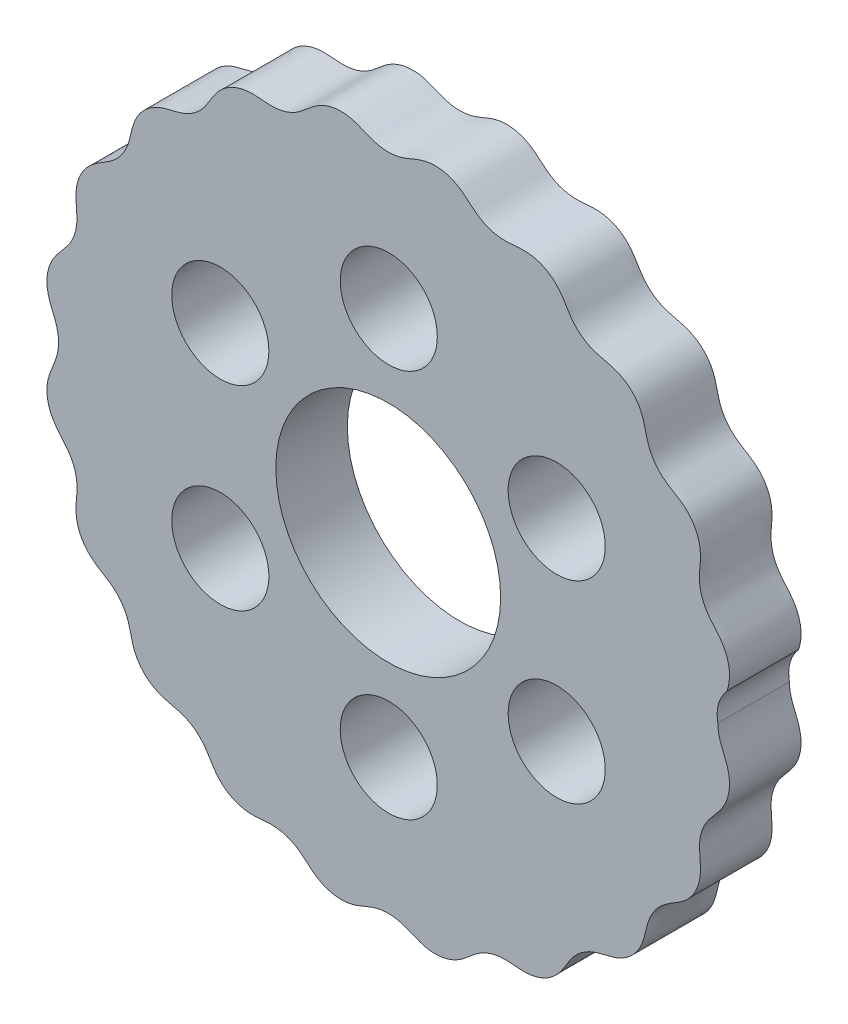
from build123d import *

# Parameters (mm, degrees)
BOSS_EXTRUDE1_DEPTH = 7
SKETCH2_R           = 11
SKETCH2_R_2         = 4.75
SKETCH2_R_3         = 4.749999995
SKETCH2_R_4         = 4.750000007
SKETCH2_R_5         = 4.750000003
CUT_EXTRUDE3_DEPTH  = 48.733141781


with BuildPart() as part:
    # Sketch1 → Boss-Extrude1 (new body)
    with BuildSketch(Plane.XY):
        with BuildLine():
            add(Edge.make_bspline(
                [(32.25, 1e-09), (32.25, -0.03584026), (32.251080395, -0.107557917), (32.255942168, -0.244822693), (32.268861596, -0.42423358), (32.288126492, -0.590307491), (32.313597344, -0.75526022), (32.345083769, -0.921284338), (32.382340363, -1.086200834), (32.435743217, -1.290221504), (32.510017409, -1.532192074), (32.609572454, -1.810337489), (32.736031435, -2.123211782), (32.868409264, -2.433561535), (32.998463612, -2.744978513), (33.147670028, -3.139574299), (33.29203351, -3.625611027), (33.391238098, -4.209938144), (33.40159236, -4.963887179), (33.263092101, -5.783976593), (32.933637021, -6.632976673), (32.380720256, -7.44914111), (31.743633074, -8.128548572), (31.194565339, -8.824864423), (30.792041933, -9.563839804), (30.542619062, -10.317563139), (30.426059081, -11.150959974), (30.453700427, -12.037430256), (30.571486472, -12.961397721), (30.548973562, -13.946062453), (30.305827306, -14.908972914), (29.8488621, -15.794930036), (29.197566297, -16.55957303), (28.387565065, -17.156146763), (27.550974388, -17.611279668), (26.8094699, -18.137433767), (26.205567855, -18.754025976), (25.754198906, -19.433148369), (25.419097837, -20.210957063), (25.205654831, -21.059332432), (25.023165763, -21.946222304), (24.678918541, -22.824303369), (24.155385031, -23.610913554), (23.47258695, -24.266165938), (22.663154471, -24.7596191), (21.767380441, -25.068988477), (20.873877723, -25.241670484), (20.026176208, -25.483558737), (19.257961529, -25.852796939), (18.597014435, -26.339289543), (18.015319336, -26.96235034), (17.530200194, -27.697909274), (17.088002691, -28.493747234), (16.507844893, -29.243486782), (15.772859754, -29.859313296), (14.912564693, -30.302576631), (13.965315475, -30.54635699), (12.98025215, -30.573037387), (12.056322353, -30.455886167), (11.169960105, -30.425170838), (10.336137669, -30.538425829), (9.581252254, -30.784420953), (8.840709776, -31.184040969), (8.142429819, -31.730755162), (7.463613048, -32.368451781), (6.650013052, -32.924567132), (5.739798426, -33.282624756), (4.783005447, -33.428033479), (3.826528798, -33.360257301), (2.916983602, -33.093242599), (2.091628303, -32.709045741), (1.26637753, -32.40011834), (0.429302587, -32.239240586), (-0.391382596, -32.235565239), (-1.22968536, -32.389684614), (-2.0572378, -32.693302158), (-2.881721983, -33.078601543), (-3.788770237, -33.353385358), (-4.733774423, -33.42838768), (-5.671092486, -33.298000902), (-6.556445254, -32.967881994), (-7.350178183, -32.458558488), (-8.018687609, -31.847917072), (-8.690679722, -31.287739131), (-9.419625653, -30.856516656), (-10.184465575, -30.573711459), (-11.03571026, -30.431180216), (-11.944792517, -30.442626541), (-12.889163565, -30.566141215), (-13.895181285, -30.557956001), (-14.87113339, -30.320567678), (-15.760797756, -29.870869827), (-16.522447913, -29.233522337), (-17.118094619, -28.449212827), (-17.565712962, -27.632421294), (-18.065390764, -26.899614077), (-18.650481966, -26.294814018), (-19.296064795, -25.832745125), (-20.056657392, -25.472681848), (-20.910331773, -25.233134263), (-21.825203321, -25.057736755), (-22.751582791, -24.720739593), (-23.573115298, -24.189933119), (-24.248840304, -23.497093196), (-24.751359701, -22.680439304), (-25.064603709, -21.786008149), (-25.237894516, -20.892406484), (-25.476928432, -20.044090314), (-25.843074795, -19.274341716), (-26.326600825, -18.611224875), (-26.947330385, -18.027030012), (-27.681412221, -17.539453985), (-28.477538309, -17.097997439), (-29.229618148, -16.521157931), (-29.848604233, -15.788832927), (-30.295754573, -14.930542362), (-30.543605502, -13.984363508), (-30.57456144, -12.999231857), (-30.458084156, -12.075098728), (-30.424367357, -11.188988864), (-30.534311318, -10.354690195), (-30.776875242, -9.598734005), (-31.173567909, -8.856576796), (-31.717880897, -8.156414765), (-32.356136698, -7.477963354), (-32.915398504, -6.667140338), (-33.283154456, -5.744604994), (-33.432509226, -4.758990118), (-33.353397152, -3.75766975), (-33.047197129, -2.799491173), (-32.637917259, -1.939569952), (-32.348479254, -1.077600722), (-32.223693767, -0.223626791), (-32.259097298, 0.591019042), (-32.446410543, 1.416966955), (-32.773243466, 2.228342112), (-33.146425069, 3.05346988), (-33.382488072, 3.966548555), (-33.420035871, 4.916249167), (-33.247541542, 5.857668601), (-32.870746257, 6.745815511), (-32.306284436, 7.533437088), (-31.679184935, 8.200013939), (-31.151082078, 8.893226913), (-30.767724626, 9.62347225), (-30.533327538, 10.364780464), (-30.425852641, 11.182587503), (-30.456115217, 12.053028073), (-30.57044759, 12.961496123), (-30.549533517, 13.930765879), (-30.315621222, 14.877939042), (-29.87541213, 15.751878255), (-29.247523253, 16.509050406), (-28.46544523, 17.108273666), (-27.648960196, 17.55636261), (-26.914470828, 18.053478276), (-26.307340893, 18.636141864), (-25.842338245, 19.279662272), (-25.479266059, 20.038804033), (-25.236815929, 20.891806711), (-25.062198676, 21.806705948), (-24.729295697, 22.734354454), (-24.20202431, 23.558169194), (-23.512255201, 24.237008277), (-22.697777389, 24.74303772), (-21.804533826, 25.060153895), (-20.910965853, 25.234161069), (-20.061987548, 25.470376036), (-19.290772545, 25.833422728), (-18.625484989, 26.313982965), (-18.0388195, 26.93231861), (-17.548735535, 27.664959335), (-17.10796282, 28.461209915), (-16.534392163, 29.215784218), (-15.812944863, 29.830728484), (-14.977234069, 30.274744494), (-14.066517637, 30.526562287), (-13.124972172, 30.579491021), (-12.225320095, 30.477855894), (-11.352300693, 30.420611213), (-10.509198984, 30.5014714), (-9.724582773, 30.723575454), (-8.952700657, 31.109863531), (-8.224799511, 31.654406363), (-7.53328827, 32.309492131), (-6.713650395, 32.892779932), (-5.778866527, 33.275025561), (-4.783689107, 33.432306412), (-3.776579779, 33.356996625), (-2.817028253, 33.054939744), (-1.956947609, 32.645597809), (-1.096221684, 32.353093368), (-0.24268098, 32.224753798), (0.572143478, 32.256517558), (1.398855976, 32.440618518), (2.211303462, 32.765181102), (3.035622993, 33.139660067), (3.947616622, 33.379700709), (4.891604445, 33.421034296), (5.823512573, 33.256381407), (6.69945148, 32.893917966), (7.477767129, 32.353045748), (8.142948467, 31.731914513), (8.835724848, 31.186903416), (9.584991508, 30.780564963), (10.366383266, 30.529626848), (11.212102964, 30.423164574), (12.092486758, 30.461281464), (12.99612118, 30.571807634), (13.943649273, 30.545643795), (14.874489725, 30.315479217), (15.739983569, 29.882441225), (16.495629409, 29.261403498), (17.098384886, 28.481668508), (17.547072979, 27.665471693), (18.041630009, 26.929367925), (18.621868133, 26.319917893), (19.263294063, 25.852011417), (20.020958736, 25.485922122), (20.873264512, 25.240541889), (21.788177848, 25.066597447), (22.717076691, 24.737783832), (23.543166874, 24.214052248), (24.225109953, 23.527364126), (24.734646511, 22.715070024), (25.0556406, 21.823032223), (25.230470514, 20.929510983), (25.463891902, 20.079894914), (25.823854301, 19.307238044), (26.301409548, 18.639811686), (26.917359159, 18.050670837), (27.648460376, 17.558076142), (28.444909927, 17.117856696), (29.201785946, 16.547605137), (29.81984157, 15.82878727), (30.267636372, 14.995097053), (30.523375754, 14.085436493), (30.580435366, 13.144017152), (30.480213655, 12.243995051), (30.420588583, 11.371383627), (30.497965021, 10.527830776), (30.716858994, 9.742562755), (31.099373189, 8.968622161), (31.567480712, 8.340299437), (32.038361194, 7.819076523), (32.437316878, 7.337829001), (32.724515784, 6.927769227), (32.967242303, 6.489680677), (33.159093214, 6.026952619), (33.298790924, 5.536156351), (33.370144453, 5.089484367), (33.392607682, 4.695978095), (33.384025491, 4.360403743), (33.360509543, 4.092595223), (33.325535309, 3.859348386), (33.287278414, 3.665828734), (33.246547966, 3.497829168), (33.208210173, 3.357605542), (33.178892757, 3.259230135), (33.161701284, 3.204461577), (33.1529127, 3.177331049)],
                knots=[0.074412945, 0.074412945, 0.074412945, 0.074412945, 0.074412945, 0.075079832, 0.075746718, 0.076413605, 0.077080492, 0.077747379, 0.078414266, 0.079081153, 0.07974804, 0.081081814, 0.082415588, 0.083749362, 0.085083135, 0.086416909, 0.087750683, 0.090418231, 0.093085778, 0.095753326, 0.099621314, 0.103489302, 0.10735729, 0.111225278, 0.114346934, 0.117468589, 0.120590245, 0.123711901, 0.127579429, 0.131446956, 0.135314483, 0.13918201, 0.143133347, 0.147084683, 0.151036019, 0.154987355, 0.158192723, 0.16139809, 0.164603458, 0.167808826, 0.171509303, 0.175209781, 0.178910259, 0.182610737, 0.186332763, 0.19005479, 0.193776816, 0.197498843, 0.200724519, 0.203950195, 0.207175871, 0.210401547, 0.214124039, 0.21784653, 0.221569022, 0.225291513, 0.229159212, 0.23302691, 0.236894609, 0.240762307, 0.243884009, 0.24700571, 0.250127411, 0.253249113, 0.257116886, 0.260984658, 0.264852431, 0.268720204, 0.272442617, 0.276165031, 0.279887444, 0.283609858, 0.286835561, 0.290061263, 0.293286965, 0.296512668, 0.300234744, 0.303956821, 0.307678897, 0.311400974, 0.31510136, 0.318801747, 0.322502134, 0.32620252, 0.329407959, 0.332613398, 0.335818836, 0.339024275, 0.342975633, 0.346926991, 0.350878349, 0.354829708, 0.358697179, 0.36256465, 0.36643212, 0.370299591, 0.373421213, 0.376542834, 0.379664455, 0.382786076, 0.386654154, 0.390522232, 0.394390309, 0.398258387, 0.401980554, 0.405702722, 0.409424889, 0.413147056, 0.416372784, 0.419598511, 0.422824238, 0.426049965, 0.429772262, 0.433494558, 0.437216855, 0.440939151, 0.444807053, 0.448674955, 0.452542858, 0.45641076, 0.459532441, 0.462654122, 0.465775803, 0.468897484, 0.472765073, 0.476632662, 0.48050025, 0.484367839, 0.48831916, 0.492270481, 0.496221802, 0.500173123, 0.503378411, 0.506583699, 0.509788987, 0.512994275, 0.516694845, 0.520395415, 0.524095986, 0.527796556, 0.531602998, 0.535409439, 0.539215881, 0.543022322, 0.546079068, 0.549135814, 0.55219256, 0.555249306, 0.559056331, 0.562863355, 0.56667038, 0.570477405, 0.574345034, 0.578212663, 0.582080292, 0.585947921, 0.589069613, 0.592191305, 0.595312997, 0.598434689, 0.60230254, 0.606170391, 0.610038243, 0.613906094, 0.617628434, 0.621350774, 0.625073114, 0.628795454, 0.632021174, 0.635246894, 0.638472615, 0.641698335, 0.645420466, 0.649142598, 0.652864729, 0.65658686, 0.660287157, 0.663987454, 0.667687751, 0.671388049, 0.67459355, 0.67779905, 0.681004551, 0.684210052, 0.688161439, 0.692112826, 0.696064213, 0.7000156, 0.703966976, 0.707918351, 0.711869726, 0.715821101, 0.719026579, 0.722232057, 0.725437535, 0.728643013, 0.732343344, 0.736043676, 0.739744007, 0.743444338, 0.747166448, 0.750888558, 0.754610667, 0.758332777, 0.761558491, 0.764784206, 0.76800992, 0.771235635, 0.774958003, 0.77868037, 0.782402738, 0.786125106, 0.789992926, 0.793860747, 0.797728568, 0.801596388, 0.804718085, 0.807839781, 0.810961478, 0.814083175, 0.81795083, 0.821818485, 0.82568614, 0.829553796, 0.833276337, 0.836998878, 0.84072142, 0.844443961, 0.847669617, 0.850895272, 0.854120928, 0.857346583, 0.861068582, 0.86479058, 0.868512578, 0.872234577, 0.875935111, 0.879635646, 0.883336181, 0.887036715, 0.890242035, 0.893447355, 0.896652674, 0.899857994, 0.90380932, 0.905784983, 0.907760646, 0.909736309, 0.911711972, 0.913687635, 0.915663298, 0.917785895, 0.918847194, 0.919908493, 0.920969792, 0.922031091, 0.92256174, 0.923092389, 0.923623039, 0.924153688, 0.924153688, 0.924153688, 0.924153688, 0.924153688], degree=4))
            add(Edge.make_bspline(
                [(33.1529127, 3.177331049), (31.922295464, 1.706002382), (32.25, 1e-09)],
                knots=[0, 0, 0, 1, 1, 1], degree=2))
        make_face()
    extrude(amount=BOSS_EXTRUDE1_DEPTH)

    # Sketch2 → Cut-Extrude3 (cut, through all)
    with BuildSketch(Plane.XY.offset(7)):
        Circle(SKETCH2_R)
        with Locations((0.054422972, 18.999922056)):
            Circle(SKETCH2_R_2)
        with Locations((16.481626656, 9.452829352)):
            Circle(SKETCH2_R_2)
        with Locations((-16.427203685, 9.547092704)):
            Circle(SKETCH2_R_2)
        with Locations(Location((16.481626656, -9.452829352, 0), (0, 0, 180))):
            Circle(SKETCH2_R_3)
        with Locations(Location((0.054422972, -18.999922056, 0), (0, 0, 180))):
            Circle(SKETCH2_R_4)
        with Locations(Location((-16.427203685, -9.547092704, 0), (0, 0, 180))):
            Circle(SKETCH2_R_5)
    extrude(amount=-CUT_EXTRUDE3_DEPTH, mode=Mode.SUBTRACT)


solid = part.part
